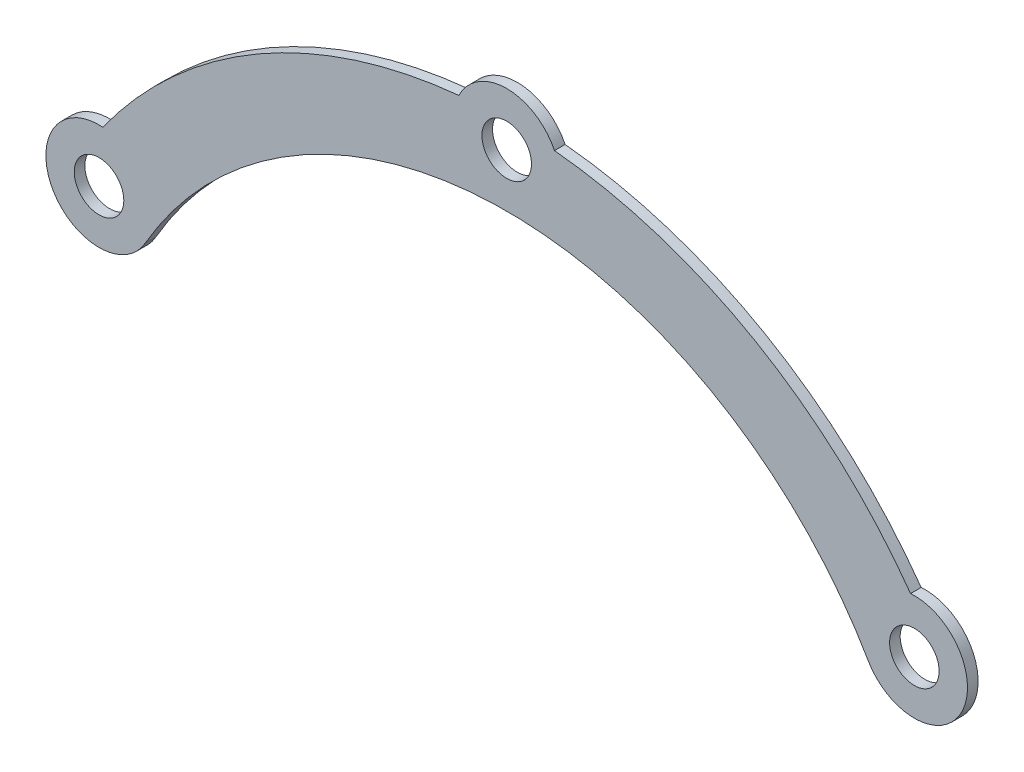
from build123d import *

# Parameters (mm, degrees)
CROQUIS1_R              = 4.445
SALIENTE_EXTRUIR1_DEPTH = 1.905


with BuildPart() as part:
    # Croquis1 → Saliente-Extruir1 (new body)
    with BuildSketch(Plane.XY):
        with BuildLine():
            ThreePointArc((-72.457149103, 51.732991832), (-81.558956176, 37.761513936), (-64.886953379, 37.4625))
            ThreePointArc((-64.886953379, 37.4625), (0, 74.925), (64.886953379, 37.4625))
            ThreePointArc((64.886953379, 37.4625), (81.558956176, 37.761513936), (72.457149103, 51.732991832))
            ThreePointArc((72.457149103, 51.732991832), (44.515, 77.102241699), (8.573510589, 88.616227725))
            ThreePointArc((8.573510589, 88.616227725), (0, 93.985), (-8.573510589, 88.616227725))
            ThreePointArc((-8.573510589, 88.616227725), (-44.515, 77.102241699), (-72.457149103, 51.732991832))
        make_face()
        with Locations((-73.140175477, 42.2275)):
            Circle(CROQUIS1_R, mode=Mode.SUBTRACT)
        with Locations((73.140175477, 42.2275)):
            Circle(CROQUIS1_R, mode=Mode.SUBTRACT)
        with Locations((0, 84.455)):
            Circle(CROQUIS1_R, mode=Mode.SUBTRACT)
    extrude(amount=SALIENTE_EXTRUIR1_DEPTH)


solid = part.part
